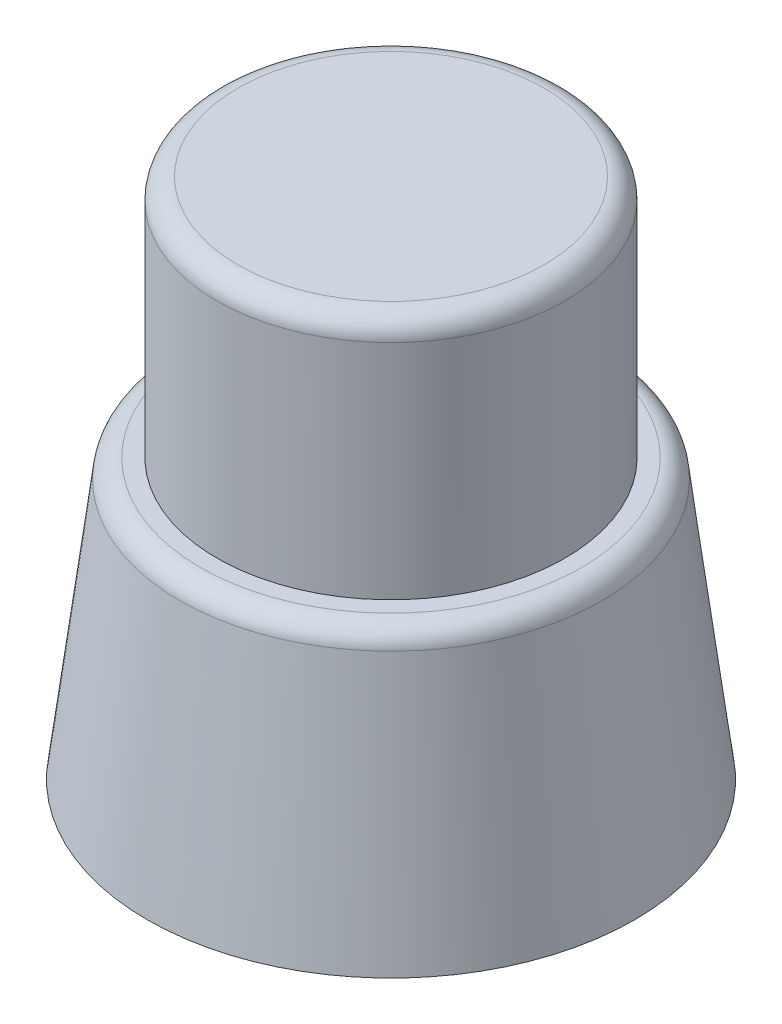
from build123d import *

# Parameters (mm, degrees)
FILLET1_R = 3
SHELL1_T  = -2


with BuildPart() as part:
    # Sketch1 → Revolve1 (revolve)
    with BuildSketch(Plane.XY, mode=Mode.PRIVATE) as revolve1_sk:
        Polygon((0, 75), (25, 75), (25, 40), (30, 40), (35, 0), (0, 0), align=None)
    revolve(revolve1_sk.sketch.rotate(Axis((0, 0, 0), (0, 1, 0)), 90), axis=Axis((0, 0, 0), (0, 1, 0)))

    # Fillet1
    fillet1_edges = [part.edges().sort_by_distance(p)[0] for p in [
        (0, 40, 30),
        (0, 75, 25),
    ]]
    fillet(fillet1_edges, radius=FILLET1_R)

    # Shell1
    shell1_openings = [part.faces().sort_by_distance(p)[0] for p in [
        (0, 0, 0),
    ]]
    offset(amount=SHELL1_T, openings=shell1_openings, kind=Kind.INTERSECTION)


solid = part.part
